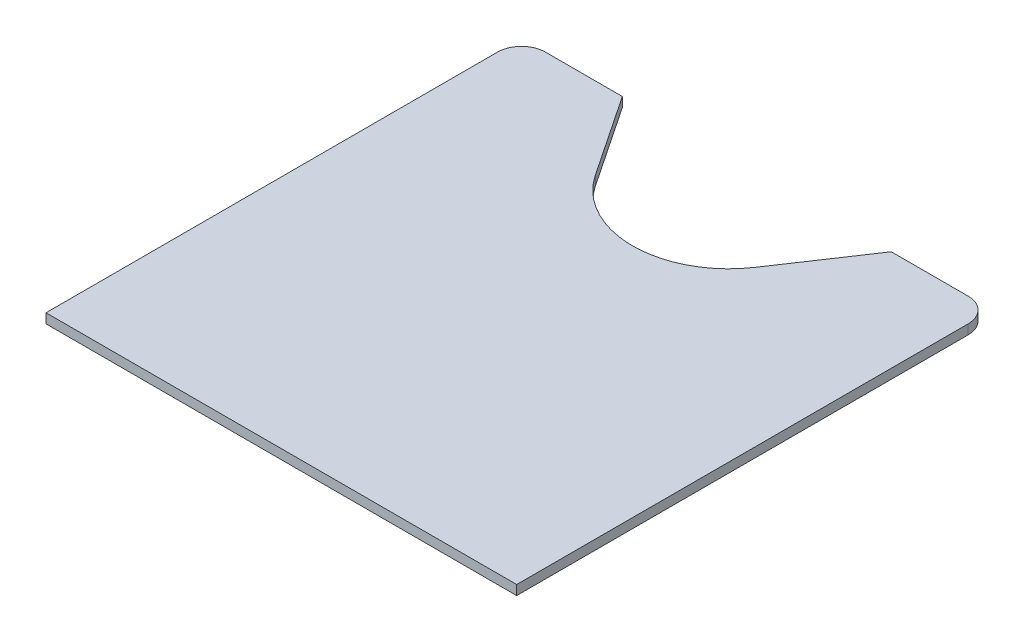
from build123d import *

# Parameters (mm, degrees)
AUFSATZ_LINEAR_AUSTRAGEN2_DEPTH = 2


with BuildPart() as part:
    # Skizze2 → Aufsatz-Linear austragen2 (new body)
    with BuildSketch(Plane(origin=(0, 0, 0), x_dir=(1, 0, 0), z_dir=(0, 1, 0))):
        with BuildLine():
            Line((-44, 50), (-28, 50))
            Line((-28, 50), (-16.61985221, 33))
            ThreePointArc((-16.61985221, 33), (0, 24.125669082), (16.61985221, 33))
            Line((16.61985221, 33), (28, 50))
            Line((28, 50), (44, 50))
            ThreePointArc((44, 50), (47.535533906, 48.535533906), (49, 45))
            Line((49, 45), (49, -49))
            Line((49, -49), (-49, -49))
            Line((-49, -49), (-49, 45))
            ThreePointArc((-49, 45), (-47.535533906, 48.535533906), (-44, 50))
        make_face()
    extrude(amount=AUFSATZ_LINEAR_AUSTRAGEN2_DEPTH)


solid = part.part
